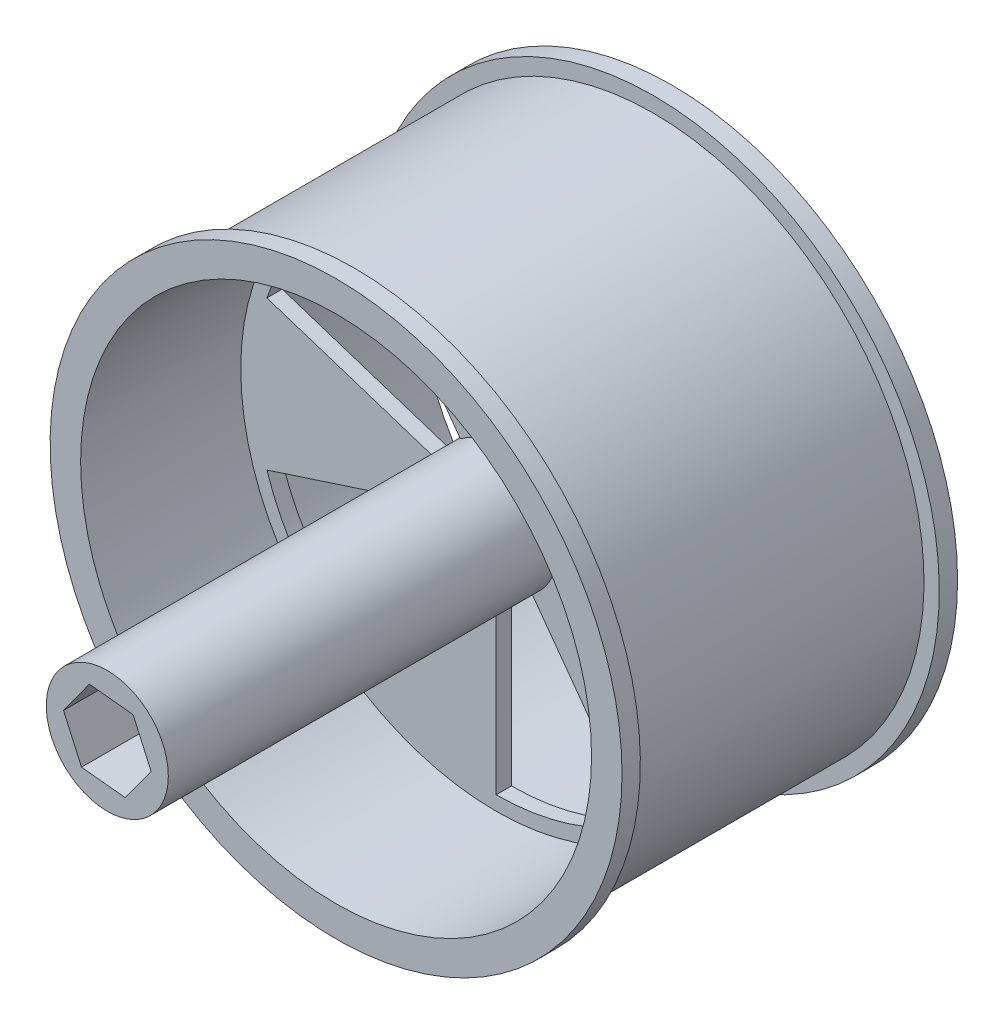
from build123d import *

# Parameters (mm, degrees)
SKETCH1_R               = 23.8125
SKETCH1_R_2             = 21.2725
BOSS_EXTRUDE1_DEPTH     = 27.94
SKETCH2_W               = 24.892
SKETCH2_H               = 1.27
SKETCH5_R               = 21.2725
BOSS_EXTRUDE2_DEPTH     = 0.635
CUT_EXTRUDE2_DEPTH      = 37.706625253
CUT_EXTRUDE2_DEPTH_BACK = 37.706625253
SKETCH7_R               = 5.08
BOSS_EXTRUDE7_DEPTH     = 32.385
CUT_EXTRUDE3_DEPTH      = 19.05


with BuildPart() as part:
    # Sketch1 → Boss-Extrude1 (new body)
    with BuildSketch(Plane.XY):
        Circle(SKETCH1_R)
        Circle(SKETCH1_R_2, mode=Mode.SUBTRACT)
    extrude(amount=BOSS_EXTRUDE1_DEPTH)

    # Sketch2 → Cut-Revolve2 (revolve, cut)
    with BuildSketch(Plane(origin=(0, 0, 0), x_dir=(0, 0, -1), z_dir=(1, 0, 0))):
        with Locations((-13.97, 23.1775)):
            Rectangle(SKETCH2_W, SKETCH2_H)
    revolve(axis=Axis((0, 0, 0), (0, 0, 1)), mode=Mode.SUBTRACT)

    # Sketch5 → Boss-Extrude2 (add, symmetric)
    with BuildSketch(Plane.XY.offset(13.97)):
        Circle(SKETCH5_R)
    extrude(amount=BOSS_EXTRUDE2_DEPTH, both=True)

    # Sketch6 → Cut-Extrude2 (cut, two sides: drawn at the far end of the back side and taken through both)
    with BuildSketch(Plane.XY.offset(14.605).offset(-CUT_EXTRUDE2_DEPTH_BACK)):
        with BuildLine():
            Line((0, 5.08), (0, 20.076289255))
            ThreePointArc((0, 20.076289255), (6.203914564, 19.093685719), (11.800546745, 16.242059191))
            Line((11.800546745, 16.242059191), (2.985949082, 4.109806331))
            ThreePointArc((2.985949082, 4.109806331), (1.569806331, 4.831367103), (0, 5.08))
        make_face()
        with BuildLine():
            Line((4.831367103, 1.569806331), (19.093685719, 6.203914564))
            ThreePointArc((19.093685719, 6.203914564), (20.076289255, 0), (19.093685719, -6.203914564))
            Line((19.093685719, -6.203914564), (4.831367103, -1.569806331))
            ThreePointArc((4.831367103, -1.569806331), (5.08, 0), (4.831367103, 1.569806331))
        make_face()
        with BuildLine():
            Line((2.985949082, -4.109806331), (11.800546745, -16.242059191))
            ThreePointArc((11.800546745, -16.242059191), (6.203914564, -19.093685719), (0, -20.076289255))
            Line((0, -20.076289255), (0, -5.08))
            ThreePointArc((0, -5.08), (1.569806331, -4.831367103), (2.985949082, -4.109806331))
        make_face()
        with BuildLine():
            Line((-2.985949082, -4.109806331), (-11.800546745, -16.242059191))
            ThreePointArc((-11.800546745, -16.242059191), (-16.242059191, -11.800546745), (-19.093685719, -6.203914564))
            Line((-19.093685719, -6.203914564), (-4.831367103, -1.569806331))
            ThreePointArc((-4.831367103, -1.569806331), (-4.109806331, -2.985949082), (-2.985949082, -4.109806331))
        make_face()
        with BuildLine():
            Line((-4.831367103, 1.569806331), (-19.093685719, 6.203914564))
            ThreePointArc((-19.093685719, 6.203914564), (-16.242059191, 11.800546745), (-11.800546745, 16.242059191))
            Line((-11.800546745, 16.242059191), (-2.985949082, 4.109806331))
            ThreePointArc((-2.985949082, 4.109806331), (-4.109806331, 2.985949082), (-4.831367103, 1.569806331))
        make_face()
    extrude(amount=CUT_EXTRUDE2_DEPTH + CUT_EXTRUDE2_DEPTH_BACK, mode=Mode.SUBTRACT)

    # Sketch7 → Boss-Extrude7 (add)
    with BuildSketch(Plane.XY.offset(14.605)):
        Circle(SKETCH7_R)
    extrude(amount=BOSS_EXTRUDE7_DEPTH)

    # Sketch8 → Cut-Extrude3 (cut)
    with BuildSketch(Plane.XY.offset(46.99)):
        Polygon((-1.498265311, 3.346047578), (-3.64689486, 0.375487968), (-2.148629549, -2.97055961), (1.498265311, -3.346047578), (3.64689486, -0.375487968), (2.148629549, 2.97055961), align=None)
    extrude(amount=-CUT_EXTRUDE3_DEPTH, mode=Mode.SUBTRACT)


solid = part.part
